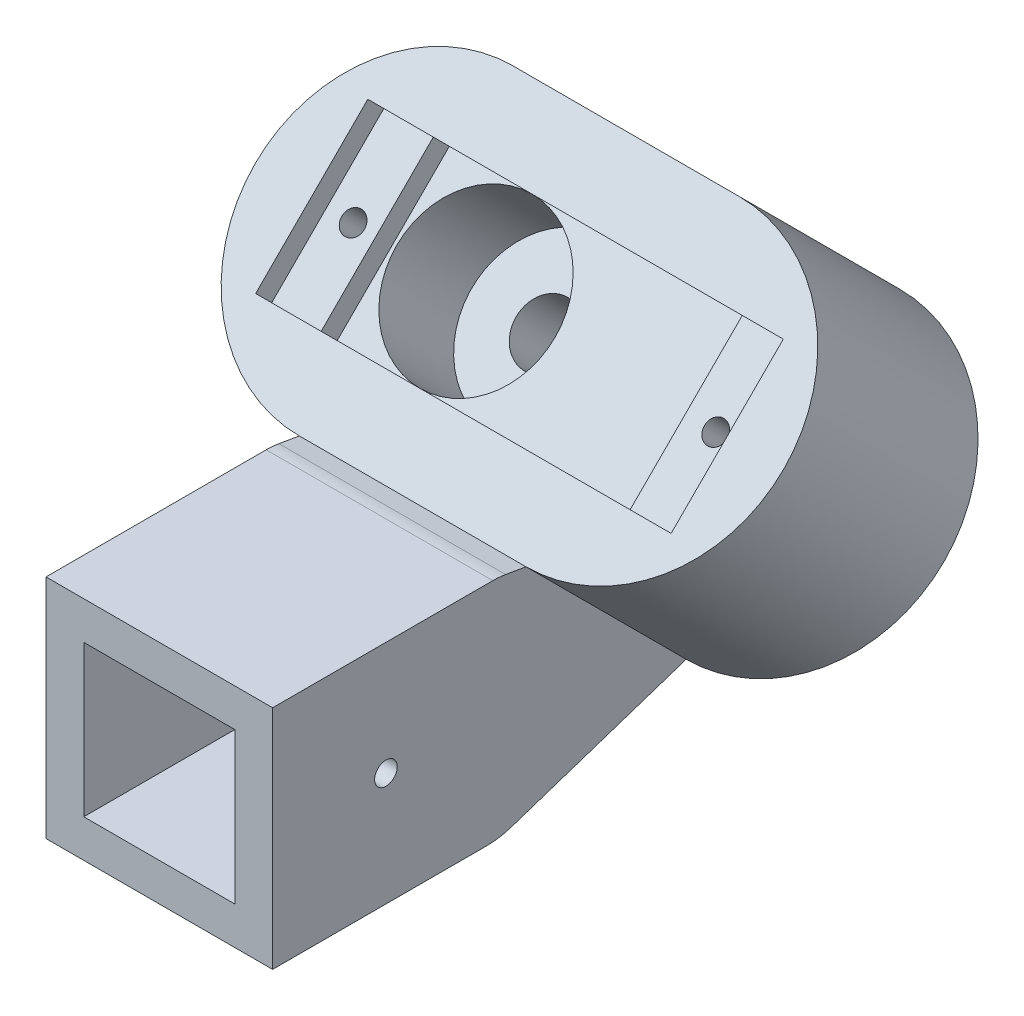
from build123d import *

# Parameters (mm, degrees)
SKETCH1_W           = 30
SKETCH1_H           = 30
BOSS_EXTRUDE1_DEPTH = 30
BOSS_EXTRUDE3_DEPTH = 30
SKETCH19_W          = 55
SKETCH19_H          = 21
CUT_EXTRUDE2_DEPTH  = 3
SKETCH20_R          = 1.5
CUT_EXTRUDE3_DEPTH  = 10
SKETCH21_R          = 10.5
CUT_EXTRUDE4_DEPTH  = 30
SKETCH22_W          = 40.9
SKETCH22_H          = 21
CUT_EXTRUDE7_DEPTH  = 3
FILLET2_R           = 10
FILLET3_R           = 10
SKETCH23_R          = 1.5
CUT_EXTRUDE8_DEPTH  = 30
SKETCH24_W          = 23.993806076
SKETCH24_H          = 21.426788773
SKETCH24_R          = 4
BOSS_EXTRUDE4_DEPTH = 10
SKETCH25_W          = 20
SKETCH25_H          = 20
CUT_EXTRUDE10_DEPTH = 30


with BuildPart() as part:
    # Sketch1 → Boss-Extrude1 (new body)
    with BuildSketch(Plane.XY):
        Rectangle(SKETCH1_W, SKETCH1_H)
        Polygon((-3.181061689, 4.218151635), (-0.042296032, 4.218151635), (3.181061689, 4.218151635), (5.633333333, 6.670423279), (5.633333333, 8.284397195), (2.733333333, 8.284397195), (2.733333333, 10), (10, 10), (10, 2.733333333), (8.80386145, 2.733333333), (8.80386145, 5.633333333), (6.670423279, 5.633333333), (4.218151635, 3.181061689), (4.218151635, 0.042296032), (4.218151635, -3.181061689), (6.670423279, -5.633333333), (8.284397195, -5.633333333), (8.284397195, -2.733333333), (10, -2.733333333), (10, -10), (2.733333333, -10), (2.733333333, -8.80386145), (5.633333333, -8.80386145), (5.633333333, -6.670423279), (3.181061689, -4.218151635), (0.042296032, -4.218151635), (-3.181061689, -4.218151635), (-5.633333333, -6.670423279), (-5.633333333, -8.284397195), (-2.733333333, -8.284397195), (-2.733333333, -10), (-10, -10), (-10, -2.733333333), (-8.80386145, -2.733333333), (-8.80386145, -5.633333333), (-6.670423279, -5.633333333), (-4.218151635, -3.181061689), (-4.218151635, -0.042296032), (-4.218151635, 3.181061689), (-6.670423279, 5.633333333), (-8.284397195, 5.633333333), (-8.284397195, 2.733333333), (-10, 2.733333333), (-10, 10), (-2.733333333, 10), (-2.733333333, 8.80386145), (-5.633333333, 8.80386145), (-5.633333333, 6.670423279), align=None, mode=Mode.SUBTRACT)
    extrude(amount=BOSS_EXTRUDE1_DEPTH)



with BuildPart() as body_2:
    # Sketch9 → Boss-Extrude3 (new body)
    with BuildSketch(Plane(origin=(15, 17.928932188, -7.071067812), x_dir=(1, 0, 0), z_dir=(0, 0.7071067811865437, 0.7071067811865515))):
        with BuildLine():
            Line((0, -5), (-30, -5))
            ThreePointArc((-30, -5), (-50, 15), (-30, 35))
            Line((-30, 35), (0, 35))
            ThreePointArc((0, 35), (20, 15), (0, -5))
        make_face()
    extrude(amount=-BOSS_EXTRUDE3_DEPTH)


with BuildPart() as part_1:
    add(part.part)

    add(body_2.part)  # Loft5 merges body 2
    # Sketch16 → Loft5 section 0
    with BuildSketch(Plane(origin=(0, 8.964466094, -8.964466094), x_dir=(1, 0, 0), z_dir=(0, -0.7071067811865513, 0.7071067811865438))):
        with BuildLine():
            Line((-15, 7.67766953), (15, 7.67766953))
            Line((15, 7.67766953), (15, -22.32233047))
            Line((15, -22.32233047), (-15, -22.32233047))
            Line((-15, -22.32233047), (-15, 7.67766953))
        make_face()
    # Sketch17 → Loft5 section 1
    with BuildSketch(Plane(origin=(0, 0, 0), x_dir=(-1, 0, 0), z_dir=(0, 0, -1))):
        with BuildLine():
            Line((15, 15), (-15, 15))
            Line((-15, 15), (-15, -15))
            Line((-15, -15), (15, -15))
            Line((15, -15), (15, 15))
        make_face()
    loft()

    # Sketch19 → Cut-Extrude2 (cut)
    with BuildSketch(Plane(origin=(0, 5.428932188, 5.428932188), x_dir=(1, 0, 0), z_dir=(0, 0.7071067811865438, 0.7071067811865513))):
        with Locations((0, 32.67766953)):
            Rectangle(SKETCH19_W, SKETCH19_H)
    extrude(amount=-CUT_EXTRUDE2_DEPTH, mode=Mode.SUBTRACT)

    # Sketch20 → Cut-Extrude3 (cut)
    with BuildSketch(Plane(origin=(0, 3.307611845, 3.307611845), x_dir=(1, 0, 0), z_dir=(0, 0.7071067811865438, 0.7071067811865512))):
        with Locations(Location((24, 32.473176799, 0), (0, 0, 270))):
            Circle(SKETCH20_R)
        with Locations(Location((-24, 32.473176799, 0), (0, 0, 270))):
            Circle(SKETCH20_R)
    extrude(amount=-CUT_EXTRUDE3_DEPTH, mode=Mode.SUBTRACT)

    # Sketch21 → Cut-Extrude4 (cut)
    with BuildSketch(Plane(origin=(0, 3.307611845, 3.307611845), x_dir=(1, 0, 0), z_dir=(0, 0.7071067811865438, 0.7071067811865512))):
        with Locations(Location((-10, 32.67766953, 0), (0, 0, 270))):
            Circle(SKETCH21_R)
    extrude(amount=-CUT_EXTRUDE4_DEPTH, mode=Mode.SUBTRACT)

    # Sketch22 → Cut-Extrude7 (cut)
    with BuildSketch(Plane(origin=(0, 3.307611845, 3.307611845), x_dir=(1, 0, 0), z_dir=(0, 0.7071067811865438, 0.7071067811865512))):
        with Locations((-0.5, 32.67766953)):
            Rectangle(SKETCH22_W, SKETCH22_H)
    extrude(amount=-CUT_EXTRUDE7_DEPTH, mode=Mode.SUBTRACT)

    # Fillet2
    fillet2_edges = [part_1.edges().sort_by_distance(p)[0] for p in [
        (0, 15, 0),
    ]]
    fillet(fillet2_edges, radius=FILLET2_R)

    # Fillet3
    fillet3_edges = [part_1.edges().sort_by_distance(p)[0] for p in [
        (0, -15, 0),
    ]]
    fillet(fillet3_edges, radius=FILLET3_R)

    # Sketch23 → Cut-Extrude8 (cut)
    with BuildSketch(Plane(origin=(15, 0, 0), x_dir=(0, 0, -1), z_dir=(1, 0, 0))):
        with Locations(Location((-15, 0, 0), (0, 0, 90))):
            Circle(SKETCH23_R)
    extrude(amount=-CUT_EXTRUDE8_DEPTH, mode=Mode.SUBTRACT)

    # Sketch24 → Boss-Extrude4 (add)
    with BuildSketch(Plane(origin=(0, -15.784271247, -15.784271247), x_dir=(1, 0, 0), z_dir=(0, -0.7071067811865438, -0.7071067811865513))):
        with Locations((-10.45, -32.473176799)):
            Rectangle(SKETCH24_W, SKETCH24_H)
        with Locations(Location((-10.45, -32.473176799, 0), (0, 0, 270))):
            Circle(SKETCH24_R, mode=Mode.SUBTRACT)
    extrude(amount=-BOSS_EXTRUDE4_DEPTH)

    # Sketch25 → Cut-Extrude10 (cut)
    with BuildSketch(Plane.XY.offset(30)):
        Rectangle(SKETCH25_W, SKETCH25_H)
    extrude(amount=-CUT_EXTRUDE10_DEPTH, mode=Mode.SUBTRACT)


solid = part_1.part
